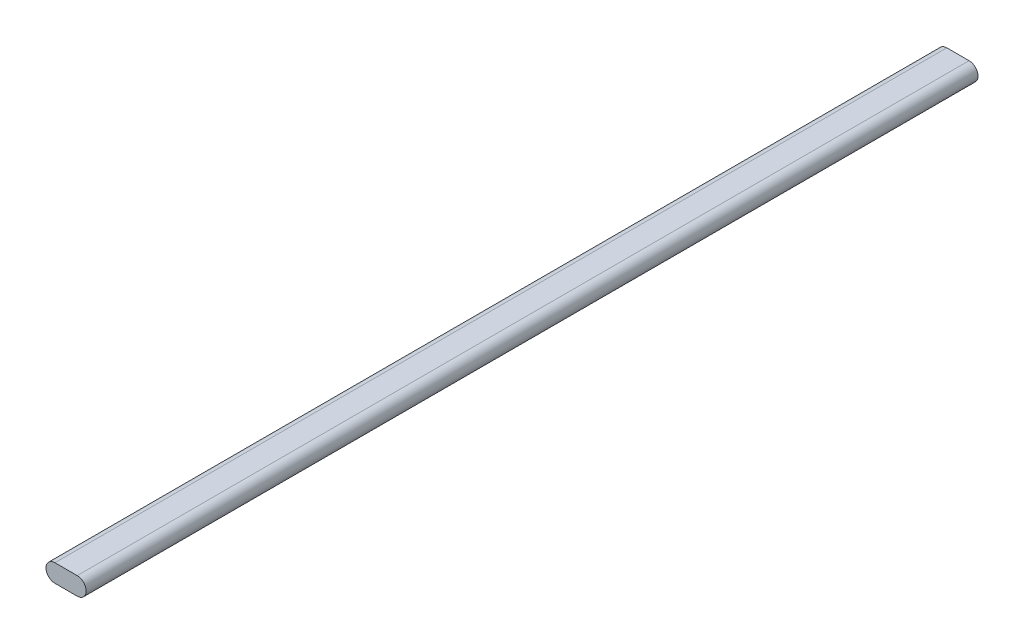
from build123d import *

# Parameters (mm, degrees)
DODANIE_WYCI_GNI_CIE1_DEPTH = 10


with BuildPart() as part:
    # Szkic1 → Dodanie-wyciągnięcie1 (new body)
    with BuildSketch(Plane.XY):
        with BuildLine():
            Line((0.25, 0.1), (0.125, 0.1))
            Line((0.125, 0.1), (0.125, 0))
            Line((0.125, 0), (0.35, 0))
            ThreePointArc((0.35, 0), (0.320710678, 0.070710678), (0.25, 0.1))
        make_face()
        with BuildLine():
            Line((0.35, 0), (0.125, 0))
            Line((0.125, 0), (0.125, -0.1))
            Line((0.125, -0.1), (0.25, -0.1))
            ThreePointArc((0.25, -0.1), (0.320710678, -0.070710678), (0.35, 0))
        make_face()
        with BuildLine():
            Line((0.125, 0.1), (0, 0.1))
            ThreePointArc((0, 0.1), (-0.070710678, 0.070710678), (-0.1, 0))
            Line((-0.1, 0), (0.125, 0))
            Line((0.125, 0), (0.125, 0.1))
        make_face()
        with BuildLine():
            Line((0.125, 0), (-0.1, 0))
            ThreePointArc((-0.1, 0), (-0.070710678, -0.070710678), (0, -0.1))
            Line((0, -0.1), (0.125, -0.1))
            Line((0.125, -0.1), (0.125, 0))
        make_face()
    extrude(amount=DODANIE_WYCI_GNI_CIE1_DEPTH)


solid = part.part
